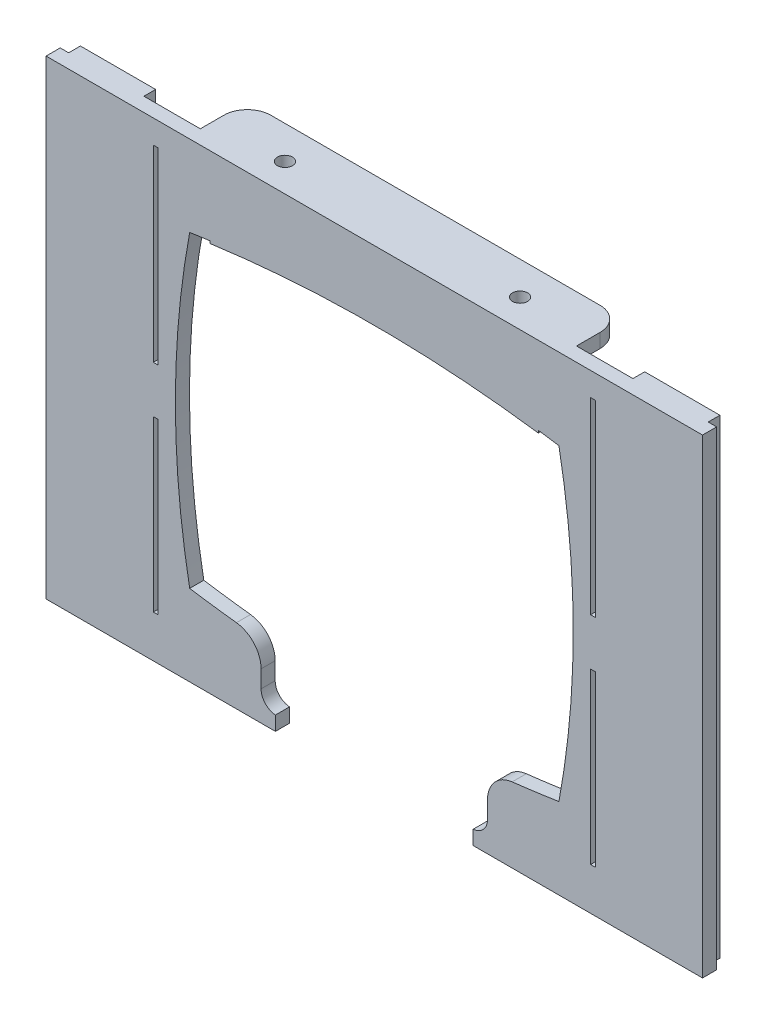
from build123d import *

# Parameters (mm, degrees)
SKETCH1_W                 = 140
SKETCH1_H                 = 100
BOSS_EXTRUDE1_DEPTH       = 3
SKETCH3_W                 = 16
SKETCH3_H                 = 100
BOSS_EXTRUDE2_DEPTH       = 2.5
SKETCH4_W                 = 12.5
SKETCH4_H                 = 5.5
CUT_EXTRUDE1_DEPTH        = 1.5
LPATTERN1_COUNT           = 4
LPATTERN1_PITCH           = 30
LPATTERN1_COPY_1_SKETCH_W = 12.5
LPATTERN1_COPY_1_SKETCH_H = 5.5
LPATTERN1_COPY_1_DEPTH    = 1.5
LPATTERN1_COPY_2_SKETCH_W = 12.5
LPATTERN1_COPY_2_SKETCH_H = 5.5
LPATTERN1_COPY_2_DEPTH    = 1.5
LPATTERN1_COPY_3_SKETCH_W = 12.5
LPATTERN1_COPY_3_SKETCH_H = 5.5
LPATTERN1_COPY_3_DEPTH    = 1.5
CUT_EXTRUDE3_DEPTH        = 123.102416029
CUT_EXTRUDE3_DEPTH_BACK   = 123.102416029
SKETCH6_W                 = 0.2
SKETCH6_H                 = 3
CUT_EXTRUDE5_DEPTH        = 1.5
LPATTERN2_COUNT           = 2
LPATTERN2_PITCH           = 30
LPATTERN2_COL_COUNT       = 2
LPATTERN2_COL_PITCH       = 30
MIRROR4_COPY_1_DEPTH      = 1.5
MIRROR4_COPY_2_DEPTH      = 1.5
SKETCH13_W                = 1
SKETCH13_H                = 40
SKETCH13_H_2              = 36
CUT_EXTRUDE7_DEPTH        = 10
SKETCH15_W                = 80
SKETCH15_H                = 3
BOSS_EXTRUDE4_DEPTH       = 10
FILLET2_R                 = 5
FILLET3_R                 = 3
SKETCH17_W                = 12.35
SKETCH17_H                = 2.25
CUT_EXTRUDE9_DEPTH        = 1.5
SKETCH18_R                = 1.6
CUT_EXTRUDE10_DEPTH       = 10
CUT_EXTRUDE11_DEPTH       = 10
SKETCH25_W                = 42.063690351
SKETCH25_H                = 4.970755329
CUT_EXTRUDE12_DEPTH       = 10


with BuildPart() as part:
    # Sketch1 → Boss-Extrude1 (new body)
    with BuildSketch(Plane.XY):
        Rectangle(SKETCH1_W, SKETCH1_H)
    extrude(amount=BOSS_EXTRUDE1_DEPTH)

    # Sketch3 → Boss-Extrude2 (add)
    with BuildSketch(Plane(origin=(0, 0, 0), x_dir=(-1, 0, 0), z_dir=(0, 0, -1))):
        with Locations((-60, 0)):
            Rectangle(SKETCH3_W, SKETCH3_H)
        with Locations((60, 0)):
            Rectangle(SKETCH3_W, SKETCH3_H)
    extrude(amount=BOSS_EXTRUDE2_DEPTH)

    # Sketch4 → Cut-Extrude1 (cut)
    with BuildSketch(Plane(origin=(0, 0, -2.5), x_dir=(-1, 0, 0), z_dir=(0, 0, -1))):
        with Locations((-60, 45)):
            Rectangle(SKETCH4_W, SKETCH4_H)
    cut_extrude1 = extrude(amount=-CUT_EXTRUDE1_DEPTH, mode=Mode.SUBTRACT)

    # Mirror1: Cut-Extrude1 across plane
    add(cut_extrude1.mirror(Plane(origin=(0, 0, 0), x_dir=(0, 0, 1), z_dir=(1, 0, 0))), mode=Mode.SUBTRACT)

    # LPattern1: Cut-Extrude1 ×4
    with Locations(*[(0, -i * LPATTERN1_PITCH, 0) for i in range(1, LPATTERN1_COUNT)]):
        add(cut_extrude1, mode=Mode.SUBTRACT)

    # LPattern1 copy 1 sketch → LPattern1 copy 1 (cut)
    with BuildSketch(Plane(origin=(0, -30, -2.5), x_dir=(1, 0, 0), z_dir=(0, 0, -1))):
        with Locations((-60, -45)):
            Rectangle(LPATTERN1_COPY_1_SKETCH_W, LPATTERN1_COPY_1_SKETCH_H)
    extrude(amount=-LPATTERN1_COPY_1_DEPTH, mode=Mode.SUBTRACT)

    # LPattern1 copy 2 sketch → LPattern1 copy 2 (cut)
    with BuildSketch(Plane(origin=(0, -60, -2.5), x_dir=(1, 0, 0), z_dir=(0, 0, -1))):
        with Locations((-60, -45)):
            Rectangle(LPATTERN1_COPY_2_SKETCH_W, LPATTERN1_COPY_2_SKETCH_H)
    extrude(amount=-LPATTERN1_COPY_2_DEPTH, mode=Mode.SUBTRACT)

    # LPattern1 copy 3 sketch → LPattern1 copy 3 (cut)
    with BuildSketch(Plane(origin=(0, -90, -2.5), x_dir=(1, 0, 0), z_dir=(0, 0, -1))):
        with Locations((-60, -45)):
            Rectangle(LPATTERN1_COPY_3_SKETCH_W, LPATTERN1_COPY_3_SKETCH_H)
    extrude(amount=-LPATTERN1_COPY_3_DEPTH, mode=Mode.SUBTRACT)

    # Sketch6 → Cut-Extrude3 (cut, two sides: drawn at the far end of the back side and taken through both)
    with BuildSketch(Plane(origin=(0, 50, 0), x_dir=(1, 0, 0), z_dir=(0, 1, 0)).offset(-CUT_EXTRUDE3_DEPTH_BACK)):
        with Locations((-69.9, -1.5)):
            Rectangle(SKETCH6_W, SKETCH6_H)
        with Locations((69.9, -1.5)):
            Rectangle(SKETCH6_W, SKETCH6_H)
    extrude(amount=CUT_EXTRUDE3_DEPTH + CUT_EXTRUDE3_DEPTH_BACK, mode=Mode.SUBTRACT)

    # Sketch11 → Cut-Extrude5 (cut)
    with BuildSketch(Plane(origin=(0, 0, -2.5), x_dir=(-1, 0, 0), z_dir=(0, 0, -1))):
        Polygon((-53.75, 12.25), (-60, -7.75), (-66.25, 12.25), align=None)
    cut_extrude5 = extrude(amount=-CUT_EXTRUDE5_DEPTH, mode=Mode.SUBTRACT)

    # LPattern2: Cut-Extrude5 ×2
    with Locations(*[(0, i * LPATTERN2_PITCH, 0) for i in range(1, LPATTERN2_COUNT)]):
        add(cut_extrude5, mode=Mode.SUBTRACT)

    # LPattern2 col: Cut-Extrude5 ×2
    with Locations(*[(0, -i * LPATTERN2_COL_PITCH, 0) for i in range(1, LPATTERN2_COL_COUNT)]):
        add(cut_extrude5, mode=Mode.SUBTRACT)

    # Mirror4: Cut-Extrude5 across plane
    add(cut_extrude5.mirror(Plane(origin=(0, 0, 0), x_dir=(0, 0, 1), z_dir=(1, 0, 0))), mode=Mode.SUBTRACT)

    # Mirror4 copy 1 sketch → Mirror4 copy 1 (cut)
    with BuildSketch(Plane(origin=(0, 30, -2.5), x_dir=(1, 0, 0), z_dir=(0, 0, -1))):
        Polygon((-53.75, -12.25), (-60, 7.75), (-66.25, -12.25), align=None)
    extrude(amount=-MIRROR4_COPY_1_DEPTH, mode=Mode.SUBTRACT)

    # Mirror4 copy 2 sketch → Mirror4 copy 2 (cut)
    with BuildSketch(Plane(origin=(0, -30, -2.5), x_dir=(1, 0, 0), z_dir=(0, 0, -1))):
        Polygon((-53.75, -12.25), (-60, 7.75), (-66.25, -12.25), align=None)
    extrude(amount=-MIRROR4_COPY_2_DEPTH, mode=Mode.SUBTRACT)

    # Sketch13 → Cut-Extrude7 (cut)
    with BuildSketch(Plane(origin=(0, 0, 0), x_dir=(-1, 0, 0), z_dir=(0, 0, -1))):
        with Locations((-46.5, 25)):
            Rectangle(SKETCH13_W, SKETCH13_H)
        with Locations((-46.5, -23)):
            Rectangle(SKETCH13_W, SKETCH13_H_2)
    cut_extrude7 = extrude(amount=-CUT_EXTRUDE7_DEPTH, mode=Mode.SUBTRACT)

    # Mirror7: Cut-Extrude7 across plane
    add(cut_extrude7.mirror(Plane(origin=(0, 0, 0), x_dir=(0, 0, 1), z_dir=(1, 0, 0))), mode=Mode.SUBTRACT)

    # Sketch15 → Boss-Extrude4 (add)
    with BuildSketch(Plane(origin=(0, 0, 0), x_dir=(-1, 0, 0), z_dir=(0, 0, -1))):
        with Locations((0, 48.5)):
            Rectangle(SKETCH15_W, SKETCH15_H)
    extrude(amount=BOSS_EXTRUDE4_DEPTH)

    # Fillet2
    fillet2_edges = [part.edges().sort_by_distance(p)[0] for p in [
        (40, 48.5, -10),
        (-40, 48.5, -10),
    ]]
    fillet(fillet2_edges, radius=FILLET2_R)

    # Fillet3
    fillet3_edges = [part.edges().sort_by_distance(p)[0] for p in [
        (0, 47, 0),
    ]]
    fillet(fillet3_edges, radius=FILLET3_R)

    # Sketch17 → Cut-Extrude9 (cut)
    with BuildSketch(Plane(origin=(0, 0, -2.5), x_dir=(-1, 0, 0), z_dir=(0, 0, -1))):
        with Locations((-60.075, -48.875)):
            Rectangle(SKETCH17_W, SKETCH17_H)
    cut_extrude9 = extrude(amount=-CUT_EXTRUDE9_DEPTH, mode=Mode.SUBTRACT)

    # Mirror8: Cut-Extrude9 across plane
    add(cut_extrude9.mirror(Plane(origin=(0, 0, 0), x_dir=(0, 0, 1), z_dir=(1, 0, 0))), mode=Mode.SUBTRACT)

    # Sketch18 → Cut-Extrude10 (cut)
    with BuildSketch(Plane(origin=(0, 50, 0), x_dir=(1, 0, 0), z_dir=(0, 1, 0))):
        with Locations(Location((-25, 3, 0), (0, 0, 180))):
            Circle(SKETCH18_R)
        with Locations(Location((25, 3, 0), (0, 0, 180))):
            Circle(SKETCH18_R)
    extrude(amount=-CUT_EXTRUDE10_DEPTH, mode=Mode.SUBTRACT)

    # Sketch24 → Cut-Extrude11 (cut)
    with BuildSketch(Plane.XY.offset(3)):
        with BuildLine():
            Line((-24.07859083, -40.000422033), (-24.07859083, -43.681991466))
            ThreePointArc((-24.07859083, -43.681991466), (-23.20025424, -45.92649129), (-21.031820585, -46.978703301))
            ThreePointArc((-21.031820585, -46.978703301), (-16.771632398, -47.280714447), (-12.507162767, -47.514622336))
            Line((-12.507162767, -47.514622336), (12.507211948, -47.514622336))
            ThreePointArc((12.507211948, -47.514622336), (16.771681578, -47.280714447), (21.031869766, -46.978703301))
            ThreePointArc((21.031869766, -46.978703301), (23.20030342, -45.92649129), (24.078640011, -43.681991466))
            Line((24.078640011, -43.681991466), (24.078640011, -40.000422033))
            ThreePointArc((24.078640011, -40.000422033), (25.579081322, -36.061125654), (29.320000625, -34.118214731))
            ThreePointArc((29.320000625, -34.118214731), (34.297548475, -33.493160314), (39.26185403, -32.770425237))
            ThreePointArc((39.26185403, -32.770425237), (42.306988396, -0.000422033), (39.26185403, 32.769581172))
            ThreePointArc((39.26185403, 32.769581172), (37.111227515, 33.094915187), (34.957907382, 33.401915241))
            Line((34.957907382, 33.401915241), (34.886534309, 32.907026835))
            ThreePointArc((34.886534309, 32.907026835), (2.459e-05, 35.306541773), (-34.886485128, 32.907026835))
            Line((-34.886485128, 32.907026835), (-34.957858201, 33.401915241))
            ThreePointArc((-34.957858201, 33.401915241), (-37.111178334, 33.094915187), (-39.261804849, 32.769581172))
            ThreePointArc((-39.261804849, 32.769581172), (-42.306939215, -0.000422033), (-39.261804849, -32.770425237))
            ThreePointArc((-39.261804849, -32.770425237), (-34.297499295, -33.493160314), (-29.319951444, -34.118214731))
            ThreePointArc((-29.319951444, -34.118214731), (-25.579032142, -36.061125654), (-24.07859083, -40.000422033))
        make_face()
    extrude(amount=-CUT_EXTRUDE11_DEPTH, mode=Mode.SUBTRACT)

    # Sketch25 → Cut-Extrude12 (cut)
    with BuildSketch(Plane(origin=(0, 0, 0), x_dir=(-1, 0, 0), z_dir=(0, 0, -1))):
        with Locations((-2.459e-05, -47.514622336)):
            Rectangle(SKETCH25_W, SKETCH25_H)
    extrude(amount=-CUT_EXTRUDE12_DEPTH, mode=Mode.SUBTRACT)


solid = part.part
